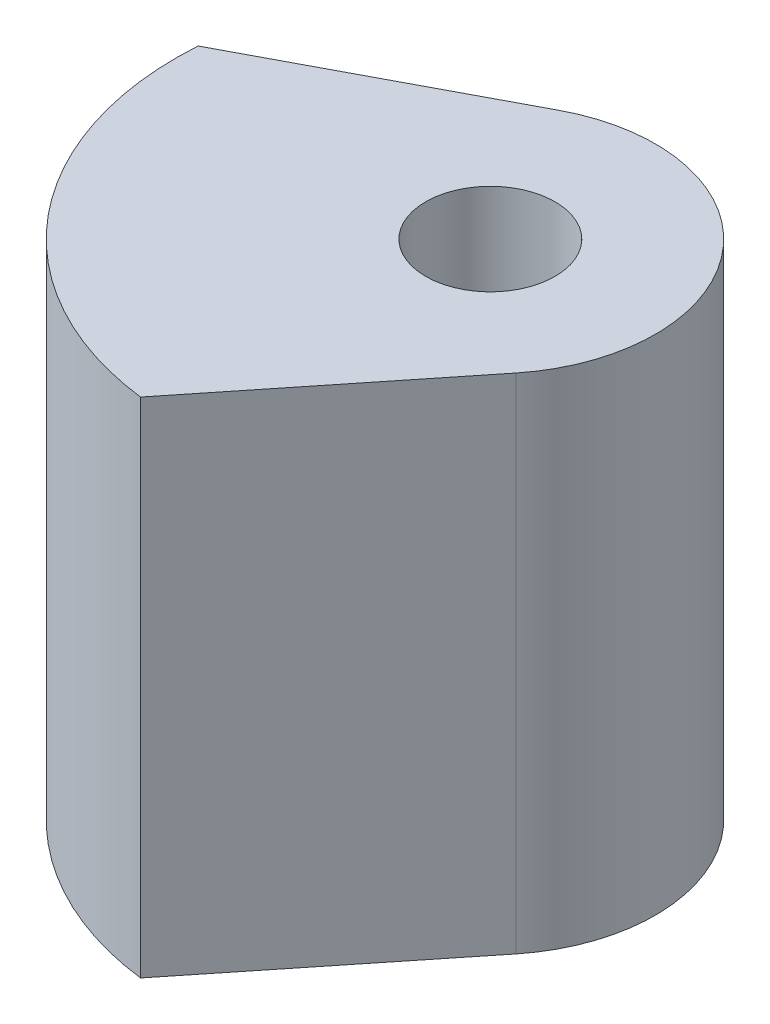
from build123d import *

# Parameters (mm, degrees)
SKETCH2_R           = 0.771298827
BOSS_EXTRUDE1_DEPTH = 6


with BuildPart() as part:
    # Sketch2 → Boss-Extrude1 (new body)
    with BuildSketch(Plane(origin=(0, 0, 0), x_dir=(1, 0, 0), z_dir=(0, 1, 0))):
        with BuildLine():
            Line((-3.481426352, -4.333258088), (-1.490513347, -1.845562237))
            ThreePointArc((-1.490513347, -1.845562237), (-1.510396267, 0.638058997), (-3.94609307, 1.124012551))
            Line((-3.94609307, 1.124012551), (-6.763419737, -0.364287047))
            ThreePointArc((-6.763419737, -0.364287047), (-5.912974689, -3.002489927), (-3.481426352, -4.333258088))
        make_face()
        with Locations(Location((-3.026917391, -0.615971895, 0), (0, 0, 270))):
            Circle(SKETCH2_R, mode=Mode.SUBTRACT)
    extrude(amount=BOSS_EXTRUDE1_DEPTH)


solid = part.part
